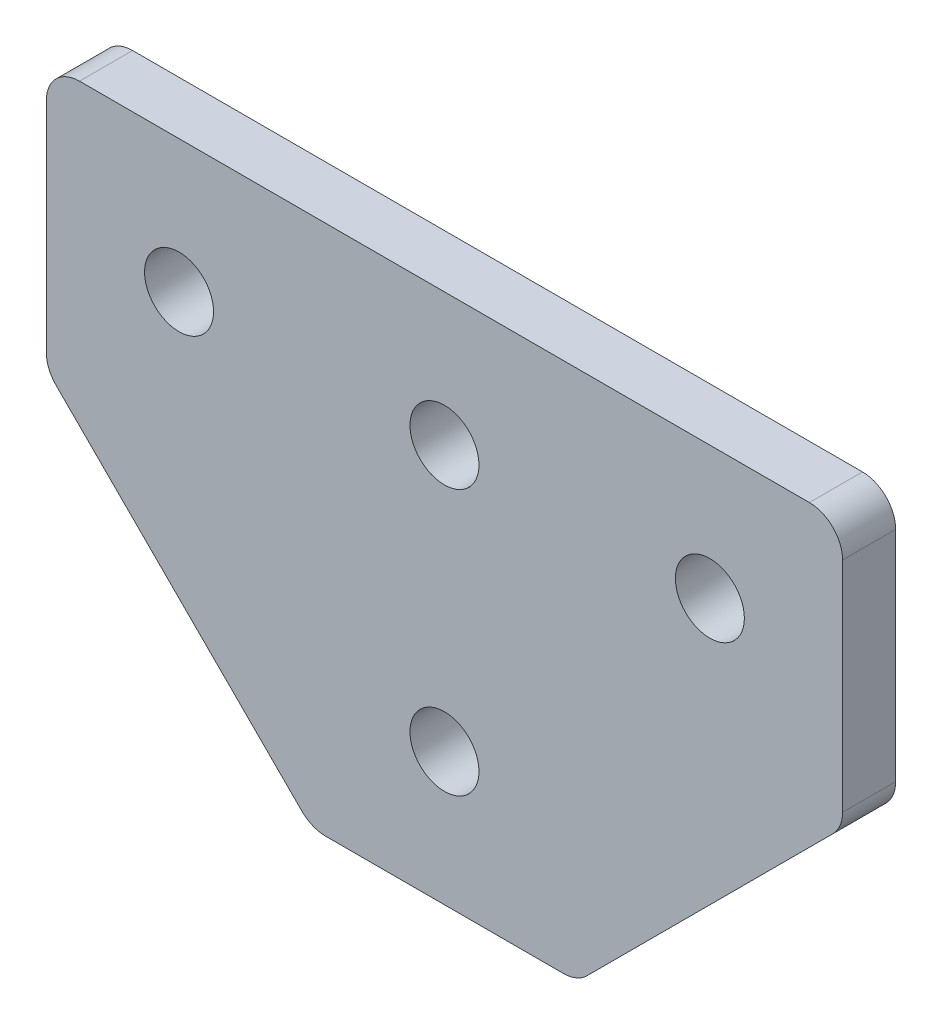
from build123d import *

# Parameters (mm, degrees)
SKETCH_1_R      = 2.6
EXTRUDE_1_DEPTH = 4


with BuildPart() as part:
    # Эскиз1 → Бобышка-Вытянуть1 (new body)
    with BuildSketch(Plane.XY):
        with BuildLine():
            Line((2.5, 0), (57.5, 0))
            ThreePointArc((57.5, 0), (59.267766953, -0.732233047), (60, -2.5))
            Line((60, -2.5), (60, -18.964466094))
            ThreePointArc((60, -18.964466094), (59.809698831, -19.921174675), (59.267766953, -20.732233047))
            Line((59.267766953, -20.732233047), (40.732233047, -39.267766953))
            ThreePointArc((40.732233047, -39.267766953), (39.921174675, -39.809698831), (38.964466094, -40))
            Line((38.964466094, -40), (21.035533906, -40))
            ThreePointArc((21.035533906, -40), (20.078825325, -39.809698831), (19.267766953, -39.267766953))
            Line((19.267766953, -39.267766953), (0.732233047, -20.732233047))
            ThreePointArc((0.732233047, -20.732233047), (0.190301169, -19.921174675), (0, -18.964466094))
            Line((0, -18.964466094), (0, -2.5))
            ThreePointArc((0, -2.5), (0.732233047, -0.732233047), (2.5, 0))
        make_face()
        with Locations((10, -10)):
            Circle(SKETCH_1_R, mode=Mode.SUBTRACT)
        with Locations((30, -10)):
            Circle(SKETCH_1_R, mode=Mode.SUBTRACT)
        with Locations((50, -10)):
            Circle(SKETCH_1_R, mode=Mode.SUBTRACT)
        with Locations((30, -30)):
            Circle(SKETCH_1_R, mode=Mode.SUBTRACT)
    extrude(amount=EXTRUDE_1_DEPTH)


solid = part.part
